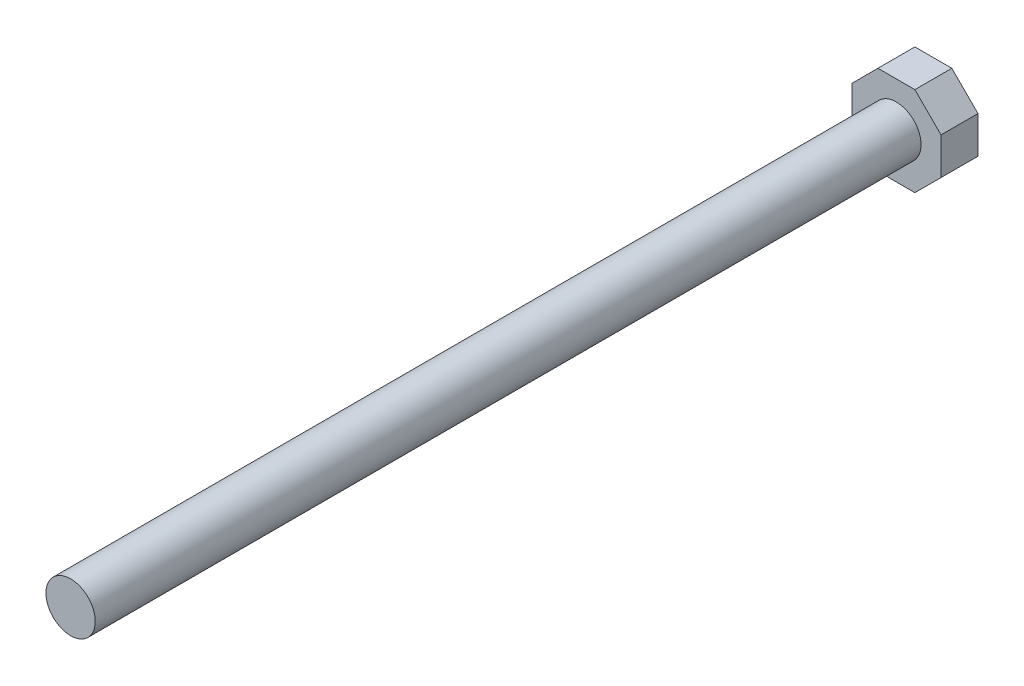
from build123d import *

# Parameters (mm, degrees)
AUFSATZ_LINEAR_AUSTRAGEN1_DEPTH = 3
SKIZZE2_R                       = 2
AUFSATZ_LINEAR_AUSTRAGEN2_DEPTH = 67


with BuildPart() as part:
    # Skizze1 → Aufsatz-Linear austragen1 (new body)
    with BuildSketch(Plane.XY):
        Polygon((-1.777039873, 0.285182154), (0.34428047, 2.406502498), (3.34428047, 2.406502498), (5.465600814, 0.285182154), (5.465600814, -2.714817846), (3.34428047, -4.83613819), (0.34428047, -4.83613819), (-1.777039873, -2.714817846), align=None)
    extrude(amount=AUFSATZ_LINEAR_AUSTRAGEN1_DEPTH)

    # Skizze2 → Aufsatz-Linear austragen2 (add)
    with BuildSketch(Plane.XY.offset(3)):
        with Locations((1.84428047, -1.214817846)):
            Circle(SKIZZE2_R)
    extrude(amount=AUFSATZ_LINEAR_AUSTRAGEN2_DEPTH)


solid = part.part
